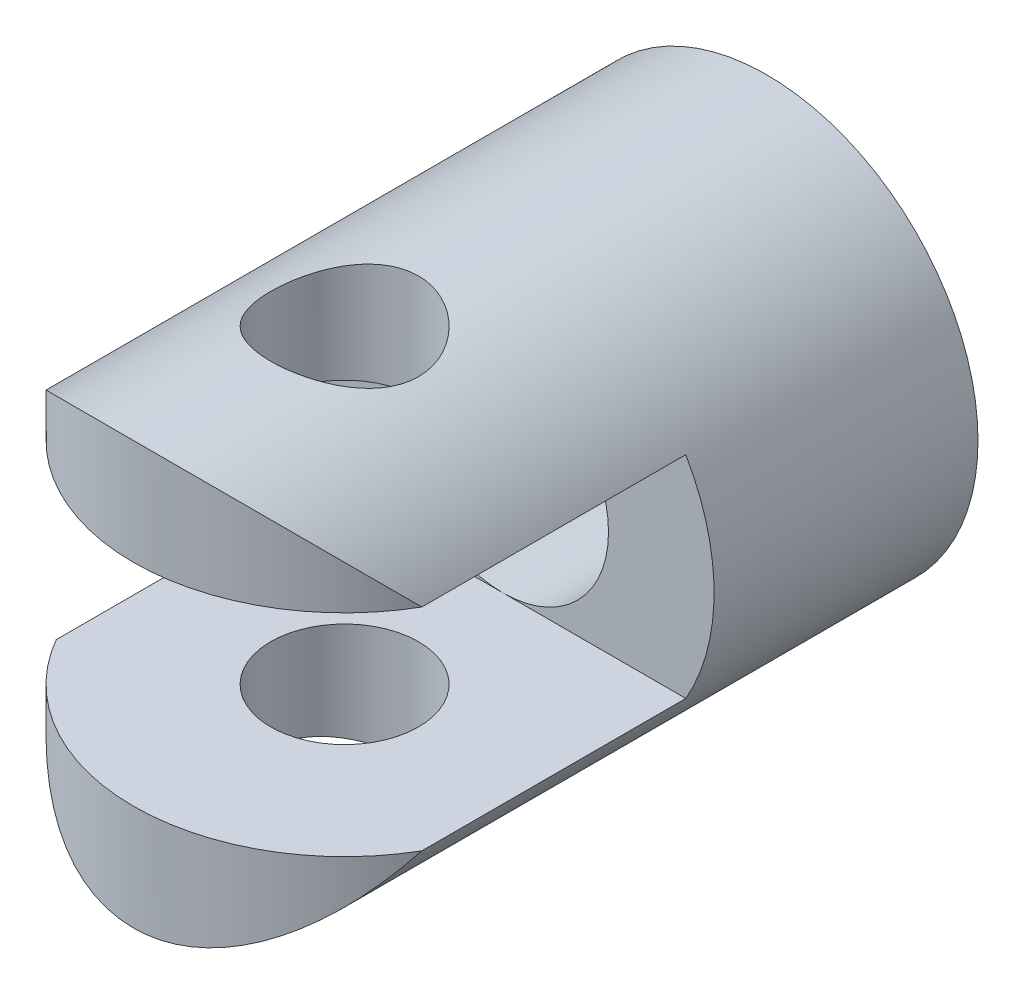
from build123d import *

# Parameters (mm, degrees)
SZKIC1_R                        = 20
SZKIC1_R_2                      = 10
DODANIE_WYCI_GNI_CIE1_DEPTH     = 60
WYTNIJ_WYCI_GNI_CIE1_DEPTH      = 60
WYTNIJ_WYCI_GNI_CIE1_DEPTH_BACK = 60
SZKIC2_R                        = 7
SZKIC3_W                        = 43.38895033
SZKIC3_H                        = 20
WYTNIJ_WYCI_GNI_CIE2_DEPTH      = 35


with BuildPart() as part:
    # Szkic1 → Dodanie-wyciągnięcie1 (new body)
    with BuildSketch(Plane.XY):
        Circle(SZKIC1_R)
        Circle(SZKIC1_R_2, mode=Mode.SUBTRACT)
    extrude(amount=DODANIE_WYCI_GNI_CIE1_DEPTH)

    # Szkic2 → Wytnij-wyciągnięcie1 (cut, two sides: drawn at the far end of the back side and taken through both)
    with BuildSketch(Plane(origin=(0, 0, 0), x_dir=(1, 0, 0), z_dir=(0, 1, 0)).offset(-WYTNIJ_WYCI_GNI_CIE1_DEPTH_BACK)):
        with BuildLine():
            ThreePointArc((0, -60), (-14.142135624, -54.142135624), (-20, -40))
            Line((-20, -40), (-20, -60))
            Line((-20, -60), (0, -60))
        make_face()
        with BuildLine():
            Line((20, -60), (20, -40))
            ThreePointArc((20, -40), (14.142135624, -54.142135624), (0, -60))
            Line((0, -60), (20, -60))
        make_face()
        with Locations((0, -40)):
            Circle(SZKIC2_R)
    extrude(amount=WYTNIJ_WYCI_GNI_CIE1_DEPTH + WYTNIJ_WYCI_GNI_CIE1_DEPTH_BACK, mode=Mode.SUBTRACT)

    # Szkic3 → Wytnij-wyciągnięcie2 (cut)
    with BuildSketch(Plane.XY.offset(60)):
        Rectangle(SZKIC3_W, SZKIC3_H)
    extrude(amount=-WYTNIJ_WYCI_GNI_CIE2_DEPTH, mode=Mode.SUBTRACT)


solid = part.part
